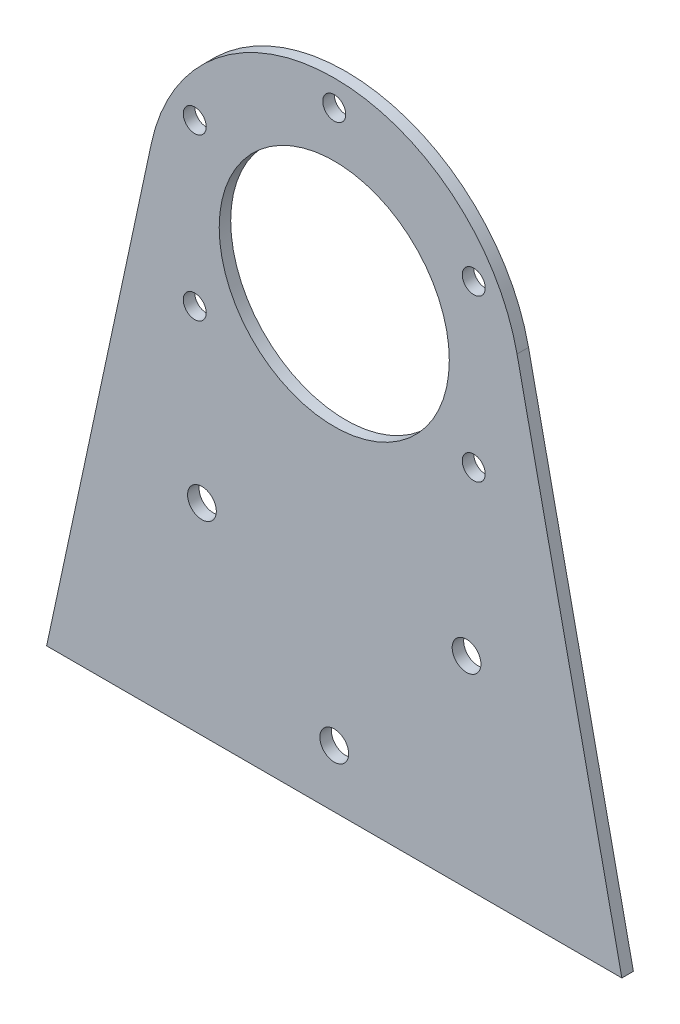
from build123d import *

# Parameters (mm, degrees)
SKETCH1_R           = 20
SKETCH1_R_2         = 2
SKETCH1_R_3         = 2.5
BOSS_EXTRUDE1_DEPTH = 2


with BuildPart() as part:
    # Sketch1 → Boss-Extrude1 (new body)
    with BuildSketch(Plane.XY):
        with BuildLine():
            Line((-50, -78), (50, -78))
            Line((50, -78), (31.774896218, 6.82685655))
            ThreePointArc((31.774896218, 6.82685655), (0, 32.5), (-31.774896218, 6.82685655))
            Line((-31.774896218, 6.82685655), (-50, -78))
        make_face()
        Circle(SKETCH1_R, mode=Mode.SUBTRACT)
        with Locations((0, 28)):
            Circle(SKETCH1_R_2, mode=Mode.SUBTRACT)
        with Locations((24.248711306, 14)):
            Circle(SKETCH1_R_2, mode=Mode.SUBTRACT)
        with Locations((24.248711306, -14)):
            Circle(SKETCH1_R_2, mode=Mode.SUBTRACT)
        with Locations((-24.248711306, -14)):
            Circle(SKETCH1_R_2, mode=Mode.SUBTRACT)
        with Locations((-24.248711306, 14)):
            Circle(SKETCH1_R_2, mode=Mode.SUBTRACT)
        with Locations((0, -68)):
            Circle(SKETCH1_R_3, mode=Mode.SUBTRACT)
        with Locations((23, -43)):
            Circle(SKETCH1_R_3, mode=Mode.SUBTRACT)
        with Locations((-23, -43)):
            Circle(SKETCH1_R_3, mode=Mode.SUBTRACT)
    extrude(amount=BOSS_EXTRUDE1_DEPTH)


solid = part.part
